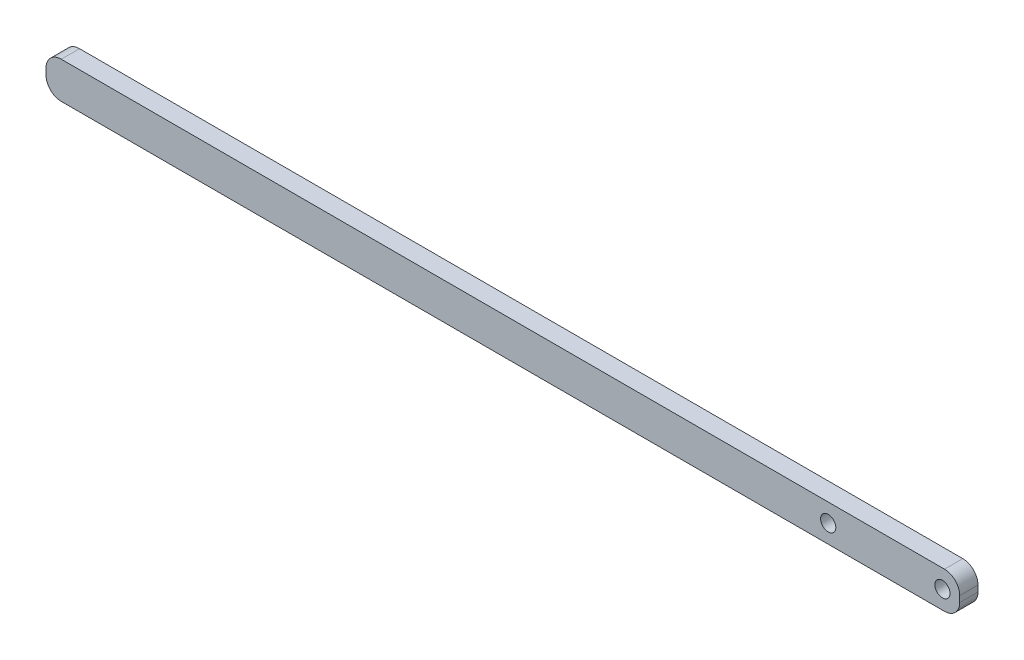
from build123d import *

# Parameters (mm, degrees)
SKETCH1_W           = 300
SKETCH1_H           = 12
BOSS_EXTRUDE1_DEPTH = 6
FILLET1_R           = 5
SKETCH2_R           = 2.5
CUT_EXTRUDE1_DEPTH  = 6
CHAMFER2_SIZE       = 1


with BuildPart() as part:
    # Sketch1 → Boss-Extrude1 (new body)
    with BuildSketch(Plane.XY):
        Rectangle(SKETCH1_W, SKETCH1_H)
    extrude(amount=BOSS_EXTRUDE1_DEPTH)

    # Fillet1
    fillet1_edges = [part.edges().sort_by_distance(p)[0] for p in [
        (150, -6, 3),
        (-150, -6, 3),
        (-150, 6, 3),
        (150, 6, 3),
    ]]
    fillet(fillet1_edges, radius=FILLET1_R)

    # Sketch2 → Cut-Extrude1 (cut)
    with BuildSketch(Plane(origin=(0, 0, 0), x_dir=(-1, 0, 0), z_dir=(0, 0, -1))):
        with Locations((-144.32263712, 0)):
            Circle(SKETCH2_R)
        with Locations((-106.82263712, 0)):
            Circle(SKETCH2_R)
    extrude(amount=-CUT_EXTRUDE1_DEPTH, mode=Mode.SUBTRACT)

    # Chamfer2
    chamfer2_edges = [part.edges().sort_by_distance(p)[0] for p in [
        (146.82263712, 0, 0),
    ]]
    chamfer(chamfer2_edges, length=CHAMFER2_SIZE)


solid = part.part
